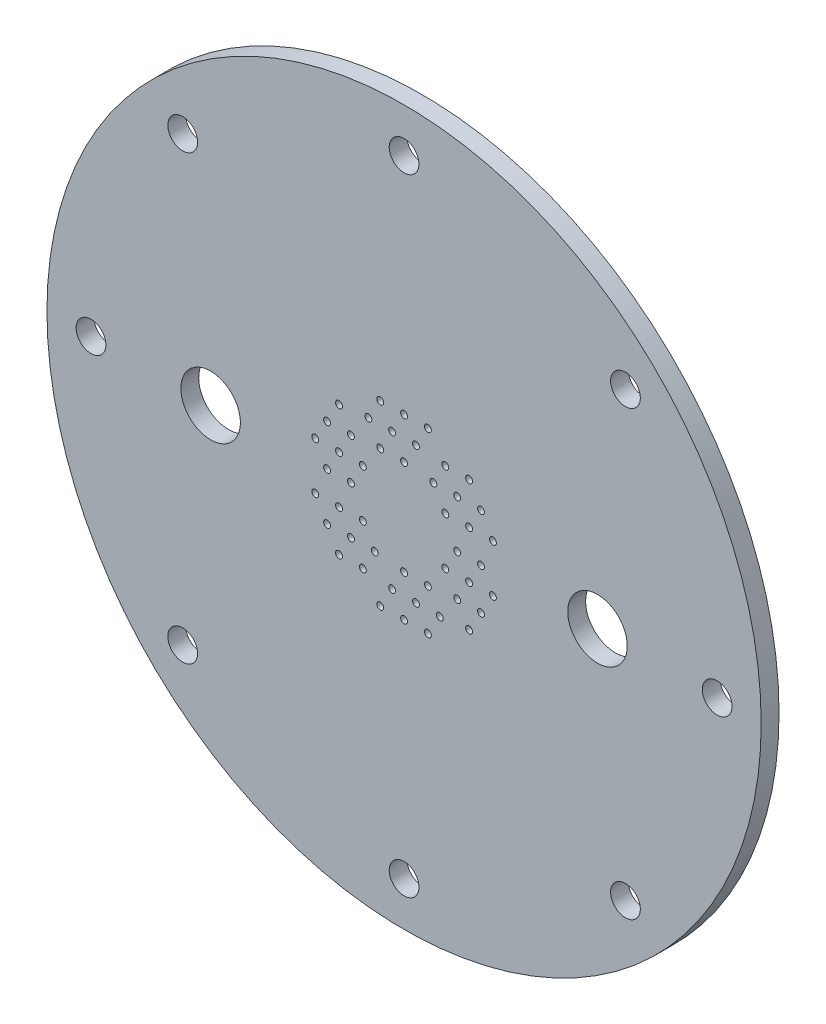
from build123d import *

# Parameters (mm, degrees)
SKETCH1_R           = 76.2
BOSS_EXTRUDE1_DEPTH = 3.81
SKETCH2_R           = 0.7366
CUT_EXTRUDE1_DEPTH  = 108.830404339
CIRPATTERN1_COUNT   = 6
SKETCH3_R           = 6.35
CUT_EXTRUDE2_DEPTH  = 108.830404339
SKETCH5_R           = 3.175
CUT_EXTRUDE3_DEPTH  = 108.830404339
CIRPATTERN2_COUNT   = 8
SKETCH6_W           = 1.27
SKETCH6_H           = 2.54


with BuildPart() as part:
    # Sketch1 → Boss-Extrude1 (new body)
    with BuildSketch(Plane.XY):
        with Locations(Location((0, 0, 0), (0, 0, 180))):
            Circle(SKETCH1_R)
    extrude(amount=BOSS_EXTRUDE1_DEPTH)

    # Sketch2 → Cut-Extrude1 (cut, through all)
    with BuildSketch(Plane(origin=(0, 0, 0), x_dir=(-1, 0, 0), z_dir=(0, 0, -1))):
        with Locations((0, 10.16)):
            Circle(SKETCH2_R)
        with Locations((2.54, 14.559409051)):
            Circle(SKETCH2_R)
        with Locations((5.08, 10.16)):
            Circle(SKETCH2_R)
        with Locations((7.62, 14.559409051)):
            Circle(SKETCH2_R)
        with Locations((-2.54, 14.559409051)):
            Circle(SKETCH2_R)
        with Locations((-5.08, 18.958818102)):
            Circle(SKETCH2_R)
        with Locations((0, 18.958818102)):
            Circle(SKETCH2_R)
        with Locations((5.08, 18.958818102)):
            Circle(SKETCH2_R)
    cut_extrude1 = extrude(amount=-CUT_EXTRUDE1_DEPTH, mode=Mode.SUBTRACT)

    # CirPattern1: Cut-Extrude1 ×6 about axis
    cirpattern1_axis = Axis((0, 0, 0), (0, 0, 1))
    for i in range(1, CIRPATTERN1_COUNT):
        add(cut_extrude1.rotate(cirpattern1_axis, i * 360 / CIRPATTERN1_COUNT), mode=Mode.SUBTRACT)

    # Sketch3 → Cut-Extrude2 (cut, through all)
    with BuildSketch(Plane(origin=(0, 0, 0), x_dir=(-1, 0, 0), z_dir=(0, 0, -1))):
        with Locations((41.275, 0)):
            Circle(SKETCH3_R)
        with Locations((-41.275, 0)):
            Circle(SKETCH3_R)
    extrude(amount=-CUT_EXTRUDE2_DEPTH, mode=Mode.SUBTRACT)

    # Sketch5 → Cut-Extrude3 (cut, through all)
    with BuildSketch(Plane(origin=(0, 0, 0), x_dir=(-1, 0, 0), z_dir=(0, 0, -1))):
        with Locations((66.802, 0)):
            Circle(SKETCH5_R)
    cut_extrude3 = extrude(amount=-CUT_EXTRUDE3_DEPTH, mode=Mode.SUBTRACT)

    # CirPattern2: Cut-Extrude3 ×8 about axis
    cirpattern2_axis = Axis((0, 0, 0), (0, 0, 1))
    for i in range(1, CIRPATTERN2_COUNT):
        add(cut_extrude3.rotate(cirpattern2_axis, i * 360 / CIRPATTERN2_COUNT), mode=Mode.SUBTRACT)

    # Sketch6 → Revolve1 (revolve)
    with BuildSketch(Plane(origin=(0, 0, 0), x_dir=(0, 0, -1), z_dir=(1, 0, 0))):
        with Locations((0.635, 52.07)):
            Rectangle(SKETCH6_W, SKETCH6_H)
    revolve(axis=Axis((0, 0, 0), (0, 0, 1)))


solid = part.part
